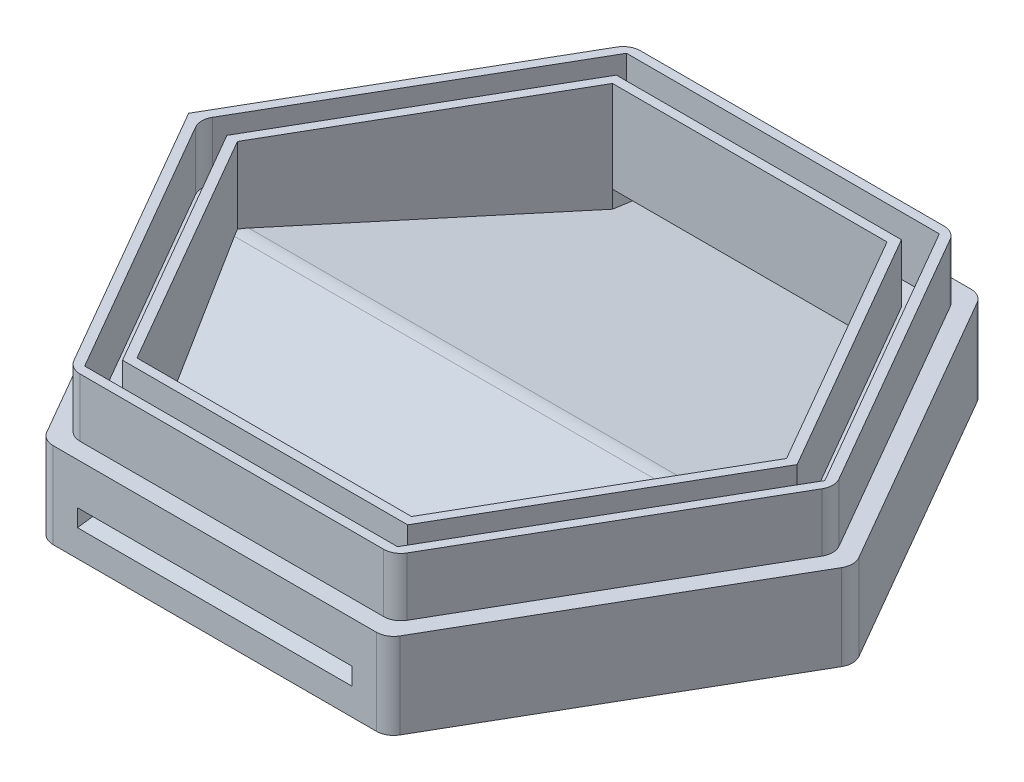
from build123d import *

# Parameters (mm, degrees)
BOSS_EXTRUDE1_DEPTH            = 25
CUT_EXTRUDE1_DEPTH             = 5
CUT_EXTRUDE7_REACH             = 136.629
CUT_EXTRUDE7_DIRECTION_2_REACH = 136.629
CUT_EXTRUDE8_REACH             = 136.629
CUT_EXTRUDE8_DIRECTION_2_REACH = 136.629
CUT_EXTRUDE9_DEPTH             = 40
CUT_EXTRUDE9_DEPTH_BACK        = 40
FILLET2_R                      = 15
BOSS_EXTRUDE5_DEPTH            = 17
FILLET3_R                      = 5


with BuildPart() as part:
    # Sketch1 → Boss-Extrude1 (new body)
    with BuildSketch(Plane(origin=(0, 0, 0), x_dir=(1, 0, 0), z_dir=(0, 1, 0))):
        Polygon((0, 0), (-50, 86.6025403784439), (-149.99999999999997, 86.60254037844393), (-199.99999999999997, 1.041e-14), (-150.00000000000003, -86.60254037844386), (-50.00000000000001, -86.60254037844389), align=None)
    extrude(amount=BOSS_EXTRUDE1_DEPTH)

    # Sketch6 → Cut-Extrude1 (cut)
    with BuildSketch(Plane(origin=(0, 25, 0), x_dir=(1, 0, 0), z_dir=(0, 1, 0))):
        Polygon((-180, 5.476e-14), (-139.99999999999997, -69.28203230275507), (-59.99999999999997, -69.28203230275508), (-20.000000000000004, 1.463e-14), (-60.000000000000014, 69.28203230275516), (-140, 69.28203230275516), align=None)
    extrude(amount=-CUT_EXTRUDE1_DEPTH, mode=Mode.SUBTRACT)

    # Cut-Extrude7: up to this plane
    cut_extrude7_end = Plane(origin=(-20.000000000000004, 20, -1.463e-14), z_dir=(0.8660254037844388, 0, -0.49999999999999983))
    # Sketch21 → Cut-Extrude7 (cut, up to the surface)
    with BuildSketch(Plane(origin=(-100, 0, 0), x_dir=(0, 0, -1), z_dir=(1, 0, 0)), mode=Mode.PRIVATE) as cut_extrude7_sk1:
        Polygon((69.28203230275516, 20), (69.28203230275516, 10.263045350293245), (3.123e-14, 20), align=None)
    cut_extrude7_tool1 = split(extrude(cut_extrude7_sk1.sketch, amount=CUT_EXTRUDE7_REACH, mode=Mode.PRIVATE), bisect_by=cut_extrude7_end, keep=Keep.BOTH, mode=Mode.PRIVATE)
    add(cut_extrude7_tool1.solids().sort_by_distance((-100, 16.754348, -46.188022))[0], mode=Mode.SUBTRACT)

    # Cut-Extrude7 direction 2: up to this plane
    cut_extrude7_direction_2_end = Plane(origin=(-140, 20, -69.28203230275516), z_dir=(-0.8660254037844388, 0, -0.4999999999999998))
    # Sketch21 → Cut-Extrude7 direction 2 (cut, up to the surface)
    with BuildSketch(Plane(origin=(-100, 0, 0), x_dir=(0, 0, -1), z_dir=(1, 0, 0)), mode=Mode.PRIVATE) as cut_extrude7_direction_2_sk1:
        Polygon((69.28203230275516, 20), (69.28203230275516, 10.263045350293245), (3.123e-14, 20), align=None)
    cut_extrude7_direction_2_tool1 = split(extrude(cut_extrude7_direction_2_sk1.sketch, amount=-CUT_EXTRUDE7_DIRECTION_2_REACH, mode=Mode.PRIVATE), bisect_by=cut_extrude7_direction_2_end, keep=Keep.BOTH, mode=Mode.PRIVATE)
    add(cut_extrude7_direction_2_tool1.solids().sort_by_distance((-100, 16.754348, -46.188022))[0], mode=Mode.SUBTRACT)

    # Cut-Extrude8: up to this plane
    cut_extrude8_end = Plane(origin=(-59.99999999999997, 20, 69.28203230275508), z_dir=(0.8660254037844388, 0, 0.49999999999999967))
    # Sketch22 → Cut-Extrude8 (cut, up to the surface)
    with BuildSketch(Plane(origin=(-100, 0, 0), x_dir=(0, 0, -1), z_dir=(1, 0, 0)), mode=Mode.PRIVATE) as cut_extrude8_sk1:
        Polygon((3.123e-14, 20), (-69.28203230275508, 10.26304535029323), (-69.28203230275508, 20), align=None)
    cut_extrude8_tool1 = split(extrude(cut_extrude8_sk1.sketch, amount=CUT_EXTRUDE8_REACH, mode=Mode.PRIVATE), bisect_by=cut_extrude8_end, keep=Keep.BOTH, mode=Mode.PRIVATE)
    add(cut_extrude8_tool1.solids().sort_by_distance((-100, 16.754348, 46.188022))[0], mode=Mode.SUBTRACT)

    # Cut-Extrude8 direction 2: up to this plane
    cut_extrude8_direction_2_end = Plane(origin=(-180, 20, -5.476e-14), z_dir=(-0.8660254037844387, 0, 0.5))
    # Sketch22 → Cut-Extrude8 direction 2 (cut, up to the surface)
    with BuildSketch(Plane(origin=(-100, 0, 0), x_dir=(0, 0, -1), z_dir=(1, 0, 0)), mode=Mode.PRIVATE) as cut_extrude8_direction_2_sk1:
        Polygon((3.123e-14, 20), (-69.28203230275508, 10.26304535029323), (-69.28203230275508, 20), align=None)
    cut_extrude8_direction_2_tool1 = split(extrude(cut_extrude8_direction_2_sk1.sketch, amount=-CUT_EXTRUDE8_DIRECTION_2_REACH, mode=Mode.PRIVATE), bisect_by=cut_extrude8_direction_2_end, keep=Keep.BOTH, mode=Mode.PRIVATE)
    add(cut_extrude8_direction_2_tool1.solids().sort_by_distance((-100, 16.754348, 46.188022))[0], mode=Mode.SUBTRACT)

    # Sketch23 → Cut-Extrude9 (cut, two sides: drawn at the far end of the back side and taken through both)
    with BuildSketch(Plane(origin=(-100, 0, 0), x_dir=(0, 0, -1), z_dir=(1, 0, 0)).offset(-CUT_EXTRUDE9_DEPTH_BACK)):
        Polygon((69.28203230275516, 10.263045350293245), (89.28203230275517, 7.452228656245558), (89.28203230275517, 12.501366518838644), (69.28203230275516, 15.312183212886326), align=None)
        Polygon((-69.28203230275516, 15.312183212886326), (-69.28203230275516, 10.263045350293245), (-89.28203230275517, 7.452228656245558), (-89.28203230275517, 12.501366518838644), align=None)
    extrude(amount=CUT_EXTRUDE9_DEPTH + CUT_EXTRUDE9_DEPTH_BACK, mode=Mode.SUBTRACT)

    # Fillet2
    fillet2_edges = [part.edges().sort_by_distance(p)[0] for p in [
        (-100, 20, -3.347e-14),
    ]]
    fillet(fillet2_edges, radius=FILLET2_R)

    # Sketch27 → Boss-Extrude5 (add)
    # profile 1 of 2: a face of its own
    with BuildSketch(Plane(origin=(0, 25, 0), x_dir=(1, 0, 0), z_dir=(0, 1, 0))):
        Polygon((-147.1132486552964, -81.60254038059946), (-52.8867513447036, -81.60254038059949), (-5.773502689407191, -2.776e-14), (-52.88675134470361, 81.60254038059944), (-147.1132486552964, 81.60254038059945), (-194.22649731059275, -2.775e-14), align=None)
        Polygon((-54.42264973081038, -78.94228634059947), (-8.845299461620776, -2.374e-14), (-54.4226497308104, 78.9422863405995), (-145.57735026918957, 78.9422863405995), (-191.1547005383792, -1.365e-14), (-145.57735026918962, -78.94228634059945), align=None, mode=Mode.SUBTRACT)
    # profile 2 of 2: a face of its own
    with BuildSketch(Plane(origin=(0, 25, 0), x_dir=(1, 0, 0), z_dir=(0, 1, 0))):
        Polygon((-141.5358983848622, -71.94228634059951), (-58.46410161513772, -71.94228634059952), (-16.92820323027549, 1.392e-14), (-58.4641016151377, 71.94228634059947), (-141.53589838486224, 71.94228634059947), (-183.0717967697245, -2.773e-14), align=None)
        Polygon((-139.99999999999997, -69.28203230275507), (-180, 6.939e-14), (-140, 69.28203230275516), (-60.000000000000014, 69.28203230275516), (-20.000000000000004, 1.463e-14), (-59.99999999999997, -69.28203230275508), align=None, mode=Mode.SUBTRACT)
    extrude(amount=BOSS_EXTRUDE5_DEPTH)

    # Fillet3
    fillet3_edges = [part.edges().sort_by_distance(p)[0] for p in [
        (-50.00000000000001, 12.5, 86.60254037844389),
        (-150.00000000000003, 12.5, 86.60254037844386),
        (-147.1132486552964, 33.5, 81.60254038059946),
        (-199.99999999999997, 12.5, -1.041e-14),
        (-52.8867513447036, 33.5, 81.60254038059949),
        (-5.773502689407191, 33.5, 2.776e-14),
        (-149.99999999999997, 12.5, -86.60254037844393),
        (-52.88675134470361, 33.5, -81.60254038059944),
        (-147.1132486552964, 33.5, -81.60254038059945),
        (-50, 12.5, -86.6025403784439),
        (0, 12.5, 0),
        (-191.1547005383792, 33.5, 1.365e-14),
    ]]
    fillet(fillet3_edges, radius=FILLET3_R)


solid = part.part
